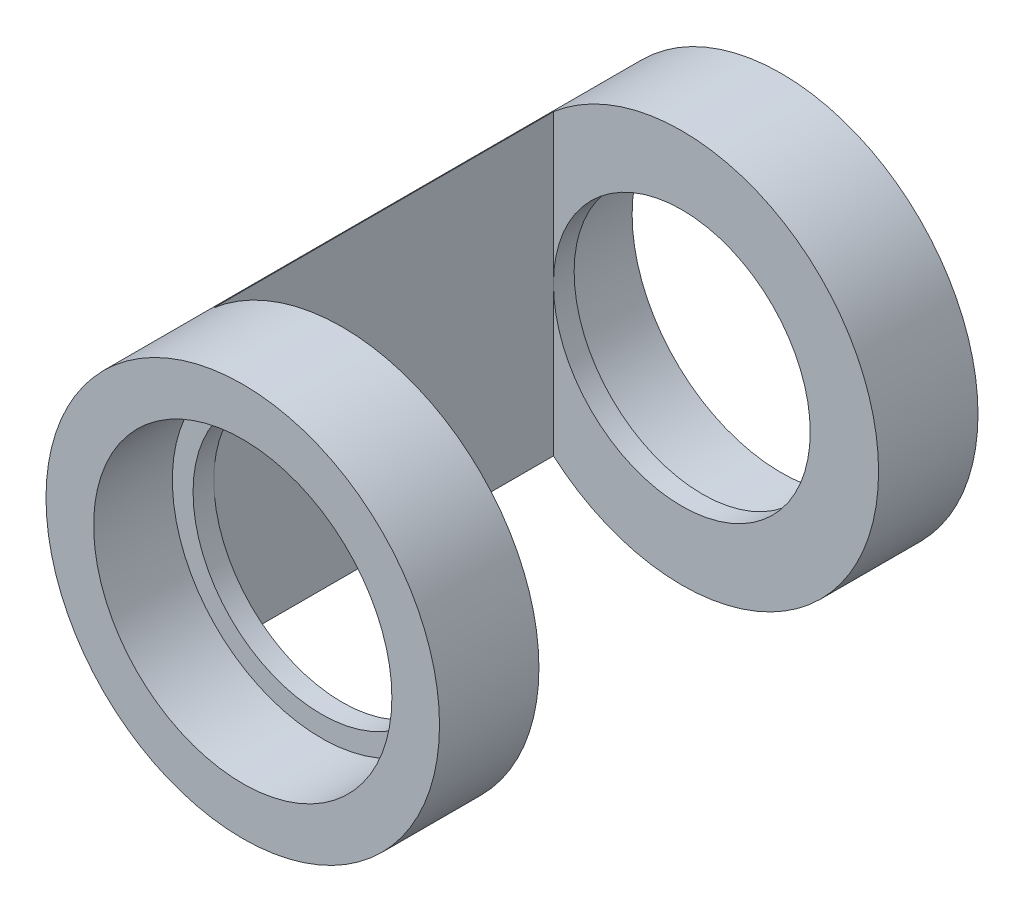
from build123d import *

# Parameters (mm, degrees)
SKETCH_1_R          = 47.5
EXTRUDE_1_DEPTH     = 130
SKETCH_2_R          = 36
CUT_EXTRUDE_1_DEPTH = 19
CUT_EXTRUDE_START   = -19
SKETCH_3_R          = 36
CUT_EXTRUDE_2_DEPTH = 19
SKETCH_4_R          = 31
CUT_EXTRUDE_3_DEPTH = 139
CUT_EXTRUDE_4_DEPTH = 82


with BuildPart() as part:
    # 草图1 → 拉伸1 (new body)
    with BuildSketch(Plane.XY):
        Circle(SKETCH_1_R)
    extrude(amount=EXTRUDE_1_DEPTH)

    # 草图2 → 切除-拉伸1 (cut)
    with BuildSketch(Plane.XY.offset(130)):
        Circle(SKETCH_2_R)
    extrude(amount=-CUT_EXTRUDE_1_DEPTH, mode=Mode.SUBTRACT)

    # 草图3 → 切除-拉伸2 (cut)
    with BuildSketch(Plane(origin=(0, 0, 0), x_dir=(-1, 0, 0), z_dir=(0, 0, -1)).offset(CUT_EXTRUDE_START)):
        with Locations(Location((0, 0, 0), (0, 0, 180))):
            Circle(SKETCH_3_R)
    extrude(amount=CUT_EXTRUDE_2_DEPTH, mode=Mode.SUBTRACT)

    # 草图4 → 切除-拉伸3 (cut)
    with BuildSketch(Plane(origin=(0, 0, 19), x_dir=(-1, 0, 0), z_dir=(0, 0, -1))):
        Circle(SKETCH_4_R)
    extrude(amount=-CUT_EXTRUDE_3_DEPTH, mode=Mode.SUBTRACT)

    # 草图5 → 切除-拉伸4 (cut)
    with BuildSketch(Plane(origin=(0, 0, 24), x_dir=(-1, 0, 0), z_dir=(0, 0, -1))):
        with BuildLine():
            Line((31, -35.989581826), (31, 35.989581826))
            ThreePointArc((31, 35.989581826), (-47.5, 0), (31, -35.989581826))
        make_face()
    extrude(amount=-CUT_EXTRUDE_4_DEPTH, mode=Mode.SUBTRACT)


solid = part.part
